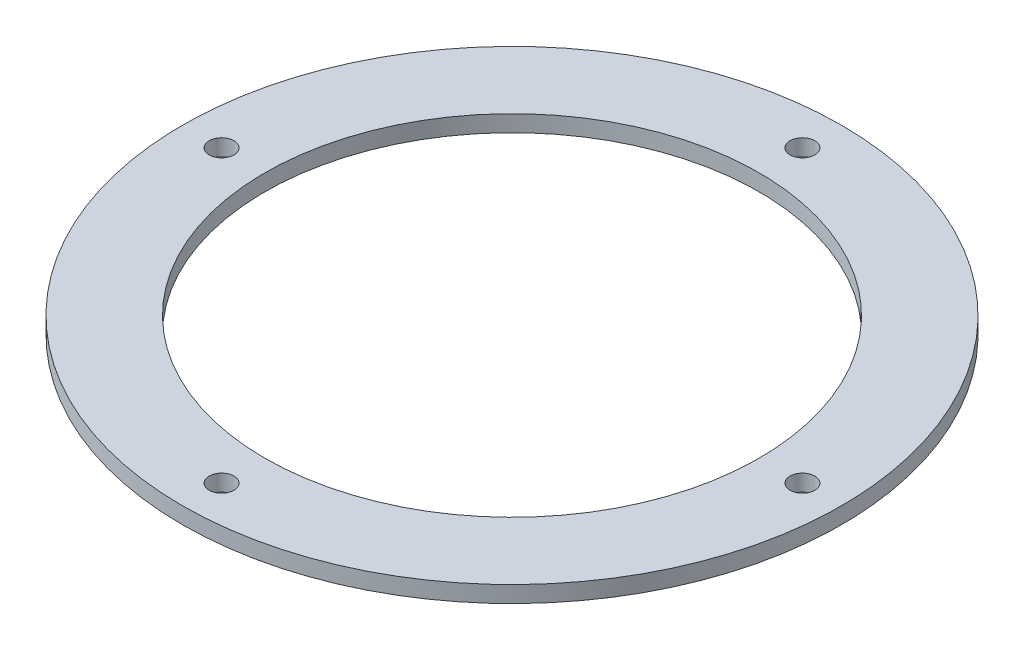
from build123d import *

# Parameters (mm, degrees)
CROQUIS_BASE_R          = 40
CROQUIS_BASE_R_2        = 30
SALIENTE_EXTRUIR1_DEPTH = 2
CROQUIS_BARRENOS_R      = 1.5
CORTAR_EXTRUIR1_DEPTH   = 2


with BuildPart() as part:
    # Croquis base → Saliente-Extruir1 (new body)
    with BuildSketch(Plane(origin=(0, 0, 0), x_dir=(1, 0, 0), z_dir=(0, 1, 0))):
        with Locations(Location((0, 0, 0), (0, 0, 270))):
            Circle(CROQUIS_BASE_R)
        with Locations(Location((0, 0, 0), (0, 0, 270))):
            Circle(CROQUIS_BASE_R_2, mode=Mode.SUBTRACT)
    extrude(amount=SALIENTE_EXTRUIR1_DEPTH)

    # Croquis Barrenos → Cortar-Extruir1 (cut)
    with BuildSketch(Plane(origin=(0, 2, 0), x_dir=(1, 0, 0), z_dir=(0, 1, 0))):
        with Locations(Location((-35.25, 0, 0), (0, 0, 270))):
            Circle(CROQUIS_BARRENOS_R)
        with Locations(Location((0, 35.25, 0), (0, 0, 270))):
            Circle(CROQUIS_BARRENOS_R)
        with Locations(Location((35.25, 0, 0), (0, 0, 270))):
            Circle(CROQUIS_BARRENOS_R)
        with Locations(Location((0, -35.25, 0), (0, 0, 270))):
            Circle(CROQUIS_BARRENOS_R)
    extrude(amount=-CORTAR_EXTRUIR1_DEPTH, mode=Mode.SUBTRACT)


solid = part.part
